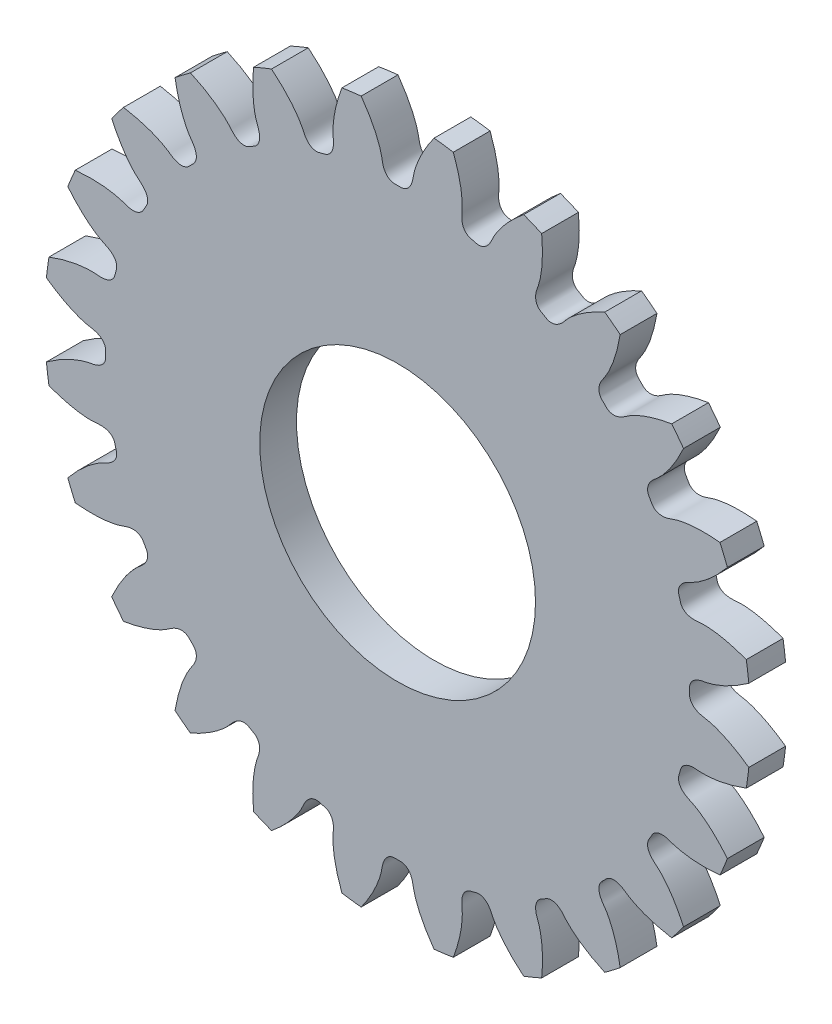
from build123d import *

# Parameters (mm, degrees)
SKETCHREVOLVESPUR03_W       = 0.2
SKETCHREVOLVESPUR03_H       = 1.920454545
TOOTHEXTRUDECUTSPUR03_DEPTH = 0.125000006
PATTERNSPUR03_COUNT         = 24
CORTAR_EXTRUIR1_REACH       = 4.709
CROQUIS1_R                  = 0.75


with BuildPart() as part:
    # SketchRevolveSpur03 → Spur03 (revolve)
    with BuildSketch(Plane(origin=(0, 0, 0), x_dir=(0, 0, -1), z_dir=(1, 0, 0))):
        with Locations((-0.025000006, 0.960227273)):
            Rectangle(SKETCHREVOLVESPUR03_W, SKETCHREVOLVESPUR03_H)
    revolve(axis=Axis((0, 0, 0), (0, 0, -1)))

    # SketchToothSpur03 → ToothExtrudeCutSpur03 (cut, symmetric)
    with BuildSketch(Plane.XY):
        with BuildLine():
            ThreePointArc((1.917102338, 0.203197432), (1.927840909, 0), (1.917102338, -0.203197432))
            add(Edge.make_bspline(
                [(1.917102338, -0.203197432), (1.902671096, -0.192608395), (1.881166168, -0.177721388), (1.852440015, -0.159684841), (1.832338342, -0.147864673), (1.813139899, -0.137314945), (1.794900578, -0.12797247), (1.777673342, -0.119771881), (1.761508142, -0.112645809), (1.746451858, -0.106524906), (1.732548186, -0.10133826), (1.719837726, -0.097012585), (1.708357439, -0.093475333), (1.698142112, -0.090645429), (1.68921963, -0.088462383), (1.67915323, -0.086258201), (1.670544437, -0.084978578), (1.663107129, -0.083737726), (1.658887543, -0.082918054), (1.654761437, -0.082017066), (1.650725898, -0.081027319), (1.646776635, -0.079946839), (1.642909078, -0.078770867), (1.639118072, -0.077493708), (1.635397978, -0.076107868), (1.63174271, -0.07460381), (1.628145886, -0.072969452), (1.62460108, -0.071189617), (1.621102262, -0.069245382), (1.617644501, -0.067113367), (1.614225058, -0.064765008), (1.610845023, -0.062165962), (1.607511658, -0.059275865), (1.60424159, -0.056048884), (1.601064848, -0.052435674), (1.598029372, -0.048387592), (1.595205066, -0.043864003), (1.592685292, -0.038843175), (1.590584047, -0.033335309), (1.589022703, -0.027396545), (1.588178333, -0.021533934), (1.587813867, -0.012365047), (1.588259592, 0), (1.587813867, 0.012365047), (1.588178333, 0.021533934), (1.589022703, 0.027396545), (1.590584047, 0.033335309), (1.592685292, 0.038843175), (1.595205066, 0.043864003), (1.598029372, 0.048387592), (1.601064848, 0.052435674), (1.60424159, 0.056048884), (1.607511658, 0.059275865), (1.610845023, 0.062165962), (1.614225058, 0.064765008), (1.617644501, 0.067113367), (1.621102262, 0.069245382), (1.62460108, 0.071189617), (1.628145886, 0.072969452), (1.63174271, 0.07460381), (1.635397978, 0.076107868), (1.639118072, 0.077493708), (1.642909078, 0.078770867), (1.646776635, 0.079946839), (1.650725898, 0.081027319), (1.654761437, 0.082017066), (1.658887543, 0.082918054), (1.663107129, 0.083737726), (1.670544437, 0.084978578), (1.67915323, 0.086258201), (1.68921963, 0.088462383), (1.698142112, 0.090645429), (1.708357439, 0.093475333), (1.719837726, 0.097012585), (1.732548186, 0.10133826), (1.746451858, 0.106524906), (1.761508142, 0.112645809), (1.777673342, 0.119771881), (1.794900578, 0.12797247), (1.813139899, 0.137314945), (1.832338342, 0.147864673), (1.852440015, 0.159684841), (1.881166168, 0.177721388), (1.902671096, 0.192608395), (1.917102338, 0.203197432)],
                knots=[0, 0, 0, 0, 0.065545551, 0.095731002, 0.124191571, 0.150927256, 0.175938059, 0.199223978, 0.220785015, 0.240621169, 0.25873244, 0.275118828, 0.289780333, 0.302716956, 0.313928696, 0.323415553, 0.340440243, 0.345782897, 0.351026739, 0.356178793, 0.361247072, 0.366240744, 0.371170327, 0.376047914, 0.380887444, 0.385704998, 0.39051915, 0.395351336, 0.400226245, 0.405172181, 0.410221341, 0.415409876, 0.42077757, 0.426366851, 0.432220755, 0.438379432, 0.444874823, 0.451723528, 0.458918688, 0.466422844, 0.474164846, 0.480555208, 0.5, 0.519444792, 0.525835154, 0.533577156, 0.541081312, 0.548276472, 0.555125177, 0.561620568, 0.567779245, 0.573633149, 0.57922243, 0.584590124, 0.589778659, 0.594827819, 0.599773755, 0.604648664, 0.60948085, 0.614295002, 0.619112556, 0.623952086, 0.628829673, 0.633759256, 0.638752928, 0.643821207, 0.648973261, 0.654217103, 0.659559757, 0.676584447, 0.686071304, 0.697283044, 0.710219667, 0.724881172, 0.74126756, 0.759378831, 0.779214985, 0.800776022, 0.824061941, 0.849072744, 0.875808429, 0.904268998, 0.934454449, 1, 1, 1, 1], degree=3))
        make_face()
    toothextrudecutspur03 = extrude(amount=TOOTHEXTRUDECUTSPUR03_DEPTH, both=True, mode=Mode.SUBTRACT)

    # PatternSpur03: ToothExtrudeCutSpur03 ×24 about axis
    patternspur03_axis = Axis((0, 0, 55), (0, 0, -1))
    for i in range(1, PATTERNSPUR03_COUNT):
        add(toothextrudecutspur03.rotate(patternspur03_axis, i * 360 / PATTERNSPUR03_COUNT), mode=Mode.SUBTRACT)

    # Croquis1 → Cortar-Extruir1 (cut, up to next)
    with BuildSketch(Plane.XY.offset(0.125000006), mode=Mode.PRIVATE) as cortar_extruir1_sk1:
        Circle(CROQUIS1_R)
    cortar_extruir1_tool1 = extrude(cortar_extruir1_sk1.sketch, amount=-CORTAR_EXTRUIR1_REACH, mode=Mode.PRIVATE) & part.part
    add(cortar_extruir1_tool1.solids().sort_by_distance((0, 0, 0.125))[0], mode=Mode.SUBTRACT)


solid = part.part
